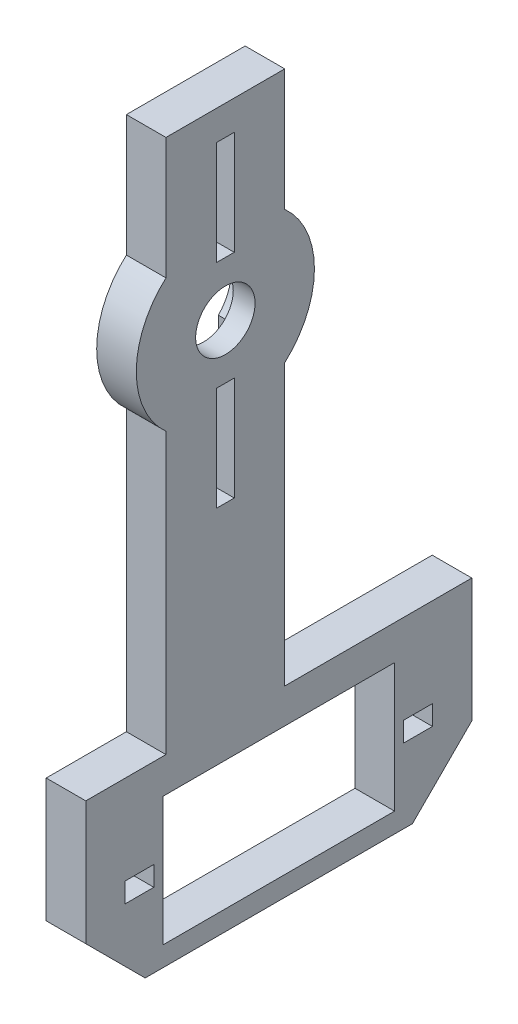
from build123d import *

# Parameters (mm, degrees)
BOSS_EXTRUDE1_START  = 66.4
SKETCH1_R            = 9
BOSS_EXTRUDE1_DEPTH  = 4
BOSS_EXTRUDE2_START  = 60
SKETCH2_W            = 4
SKETCH2_H            = 55
BOSS_EXTRUDE2_DEPTH  = 12
BOSS_EXTRUDE3_START  = 41.1
SKETCH3_W            = 4
SKETCH3_H            = 18.5
BOSS_EXTRUDE3_DEPTH  = 39
BOSS_EXTRUDE4_START  = 65.4
BOSS_EXTRUDE4_DEPTH  = 6
BOSS_EXTRUDE5_START  = 65.4
BOSS_EXTRUDE5_DEPTH  = 6
BOSS_EXTRUDE6_START  = 65.9
SKETCH6_R            = 4.6
BOSS_EXTRUDE6_DEPTH  = 2.3
BOSS_EXTRUDE7_START  = 62.7
SKETCH7_W            = 2.3
SKETCH7_H            = 17.5
BOSS_EXTRUDE7_DEPTH  = 6.6
BOSS_EXTRUDE8_START  = 65.1
SKETCH8_W            = 6
SKETCH8_H            = 10.5
BOSS_EXTRUDE8_DEPTH  = 1.8
BOSS_EXTRUDE9_START  = 62.7
SKETCH9_W            = 2.3
SKETCH9_H            = 17.5
BOSS_EXTRUDE9_DEPTH  = 6.6
BOSS_EXTRUDE10_START = 65.1
SKETCH10_W           = 6
SKETCH10_H           = 10.5
BOSS_EXTRUDE10_DEPTH = 1.8
BOSS_EXTRUDE11_START = 65.4
SKETCH11_R           = 3
BOSS_EXTRUDE11_DEPTH = 6
BOSS_EXTRUDE12_START = 48.9
SKETCH12_W           = 6
SKETCH12_H           = 13
BOSS_EXTRUDE12_DEPTH = 23.4
BOSS_EXTRUDE13_START = 45.075
SKETCH13_W           = 6
SKETCH13_H           = 2
BOSS_EXTRUDE13_DEPTH = 2.9
BOSS_EXTRUDE14_START = 73.225
SKETCH14_W           = 6
SKETCH14_H           = 2
BOSS_EXTRUDE14_DEPTH = 2.9


with BuildPart() as part:
    # Sketch1 → Boss-Extrude1 (new body)
    with BuildSketch(Plane(origin=(0, 0, 0), x_dir=(0, 0, -1), z_dir=(1, 0, 0)).offset(BOSS_EXTRUDE1_START)):
        with Locations((-66, -20)):
            Circle(SKETCH1_R)
    extrude(amount=BOSS_EXTRUDE1_DEPTH)

    # Sketch2 → Boss-Extrude2 (add)
    with BuildSketch(Plane.XY.offset(BOSS_EXTRUDE2_START)):
        with Locations((68.4, -28.5)):
            Rectangle(SKETCH2_W, SKETCH2_H)
    extrude(amount=BOSS_EXTRUDE2_DEPTH)

    # Sketch3 → Boss-Extrude3 (add)
    with BuildSketch(Plane.XY.offset(BOSS_EXTRUDE3_START)):
        with Locations((68.4, -64.25)):
            Rectangle(SKETCH3_W, SKETCH3_H)
    extrude(amount=BOSS_EXTRUDE3_DEPTH)


with BuildPart() as body_2:
    # Sketch4 → Boss-Extrude4 (new body)
    with BuildSketch(Plane(origin=(0, 0, 0), x_dir=(0, 0, -1), z_dir=(1, 0, 0)).offset(BOSS_EXTRUDE4_START)):
        Polygon((-81.1, -74.5), (-73.1, -74.5), (-81.1, -66.5), align=None)
    extrude(amount=BOSS_EXTRUDE4_DEPTH)


with BuildPart() as part_1:
    add(part.part)

    # Combine1: cut body 2
    add(body_2.part, mode=Mode.SUBTRACT)


with BuildPart() as body_2_2:
    # Sketch5 → Boss-Extrude5 (new body)
    with BuildSketch(Plane(origin=(0, 0, 0), x_dir=(0, 0, -1), z_dir=(1, 0, 0)).offset(BOSS_EXTRUDE5_START)):
        Polygon((-40.1, -74.5), (-48.1, -74.5), (-40.1, -66.5), align=None)
    extrude(amount=BOSS_EXTRUDE5_DEPTH)


with BuildPart() as part_2:
    add(part_1.part)

    # Combine2: cut body 2 2
    add(body_2_2.part, mode=Mode.SUBTRACT)


with BuildPart() as body_2_3:
    # Sketch6 → Boss-Extrude6 (new body)
    with BuildSketch(Plane(origin=(0, 0, 0), x_dir=(0, 0, -1), z_dir=(1, 0, 0)).offset(BOSS_EXTRUDE6_START)):
        with Locations((-66, -20)):
            Circle(SKETCH6_R)
    extrude(amount=BOSS_EXTRUDE6_DEPTH)


with BuildPart() as part_3:
    add(part_2.part)

    # Combine3: cut body 2 3
    add(body_2_3.part, mode=Mode.SUBTRACT)


with BuildPart() as body_2_4:
    # Sketch7 → Boss-Extrude7 (new body)
    with BuildSketch(Plane.XY.offset(BOSS_EXTRUDE7_START)):
        with Locations((67.05, -11.25)):
            Rectangle(SKETCH7_W, SKETCH7_H)
    extrude(amount=BOSS_EXTRUDE7_DEPTH)


with BuildPart() as part_4:
    add(part_3.part)

    # Combine4: cut body 2 4
    add(body_2_4.part, mode=Mode.SUBTRACT)


with BuildPart() as body_2_5:
    # Sketch8 → Boss-Extrude8 (new body)
    with BuildSketch(Plane.XY.offset(BOSS_EXTRUDE8_START)):
        with Locations((68.4, -9.25)):
            Rectangle(SKETCH8_W, SKETCH8_H)
    extrude(amount=BOSS_EXTRUDE8_DEPTH)


with BuildPart() as part_5:
    add(part_4.part)

    # Combine5: cut body 2 5
    add(body_2_5.part, mode=Mode.SUBTRACT)


with BuildPart() as body_2_6:
    # Sketch9 → Boss-Extrude9 (new body)
    with BuildSketch(Plane.XY.offset(BOSS_EXTRUDE9_START)):
        with Locations((67.05, -28.75)):
            Rectangle(SKETCH9_W, SKETCH9_H)
    extrude(amount=BOSS_EXTRUDE9_DEPTH)


with BuildPart() as part_6:
    add(part_5.part)

    # Combine6: cut body 2 6
    add(body_2_6.part, mode=Mode.SUBTRACT)


with BuildPart() as body_2_7:
    # Sketch10 → Boss-Extrude10 (new body)
    with BuildSketch(Plane.XY.offset(BOSS_EXTRUDE10_START)):
        with Locations((68.4, -30.75)):
            Rectangle(SKETCH10_W, SKETCH10_H)
    extrude(amount=BOSS_EXTRUDE10_DEPTH)


with BuildPart() as part_7:
    add(part_6.part)

    # Combine7: cut body 2 7
    add(body_2_7.part, mode=Mode.SUBTRACT)


with BuildPart() as body_2_8:
    # Sketch11 → Boss-Extrude11 (new body)
    with BuildSketch(Plane(origin=(0, 0, 0), x_dir=(0, 0, -1), z_dir=(1, 0, 0)).offset(BOSS_EXTRUDE11_START)):
        with Locations((-66, -20)):
            Circle(SKETCH11_R)
    extrude(amount=BOSS_EXTRUDE11_DEPTH)


with BuildPart() as part_8:
    add(part_7.part)

    # Combine8: cut body 2 8
    add(body_2_8.part, mode=Mode.SUBTRACT)


with BuildPart() as body_2_9:
    # Sketch12 → Boss-Extrude12 (new body)
    with BuildSketch(Plane.XY.offset(BOSS_EXTRUDE12_START)):
        with Locations((68.4, -65)):
            Rectangle(SKETCH12_W, SKETCH12_H)
    extrude(amount=BOSS_EXTRUDE12_DEPTH)


with BuildPart() as part_9:
    add(part_8.part)

    # Combine9: cut body 2 9
    add(body_2_9.part, mode=Mode.SUBTRACT)


with BuildPart() as body_2_10:
    # Sketch13 → Boss-Extrude13 (new body)
    with BuildSketch(Plane.XY.offset(BOSS_EXTRUDE13_START)):
        with Locations((68.4, -65)):
            Rectangle(SKETCH13_W, SKETCH13_H)
    extrude(amount=BOSS_EXTRUDE13_DEPTH)


with BuildPart() as part_10:
    add(part_9.part)

    # Combine10: cut body 2 10
    add(body_2_10.part, mode=Mode.SUBTRACT)


with BuildPart() as body_2_11:
    # Sketch14 → Boss-Extrude14 (new body)
    with BuildSketch(Plane.XY.offset(BOSS_EXTRUDE14_START)):
        with Locations((68.4, -65)):
            Rectangle(SKETCH14_W, SKETCH14_H)
    extrude(amount=BOSS_EXTRUDE14_DEPTH)


with BuildPart() as part_11:
    add(part_10.part)

    # Combine11: cut body 2 11
    add(body_2_11.part, mode=Mode.SUBTRACT)


solid = part_11.part
